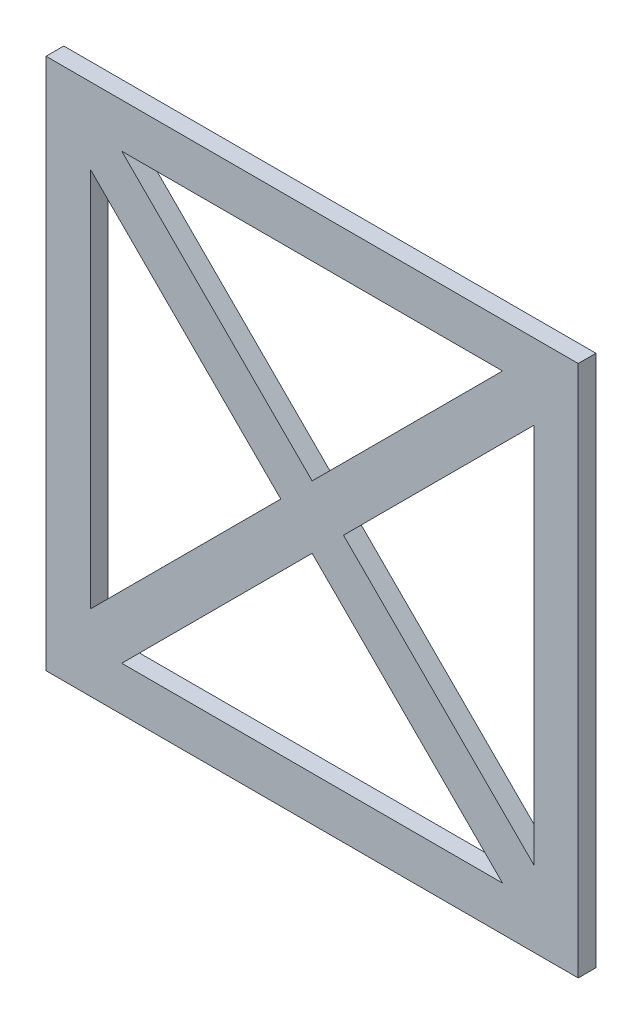
from build123d import *

# Parameters (mm, degrees)
SKETCH1_W           = 300
SKETCH1_H           = 300
BOSS_EXTRUDE1_DEPTH = 10


with BuildPart() as part:
    # Sketch1 → Boss-Extrude1 (new body)
    with BuildSketch(Plane.XY):
        Rectangle(SKETCH1_W, SKETCH1_H)
        Polygon((-107.32233047, 125), (107.32233047, 125), (0, 17.67766953), align=None, mode=Mode.SUBTRACT)
        Polygon((125, -107.32233047), (125, 107.32233047), (17.67766953, 0), align=None, mode=Mode.SUBTRACT)
        Polygon((-107.32233047, -125), (107.32233047, -125), (0, -17.67766953), align=None, mode=Mode.SUBTRACT)
        Polygon((-125, -107.32233047), (-125, 107.32233047), (-17.67766953, 0), align=None, mode=Mode.SUBTRACT)
    extrude(amount=BOSS_EXTRUDE1_DEPTH)


solid = part.part
